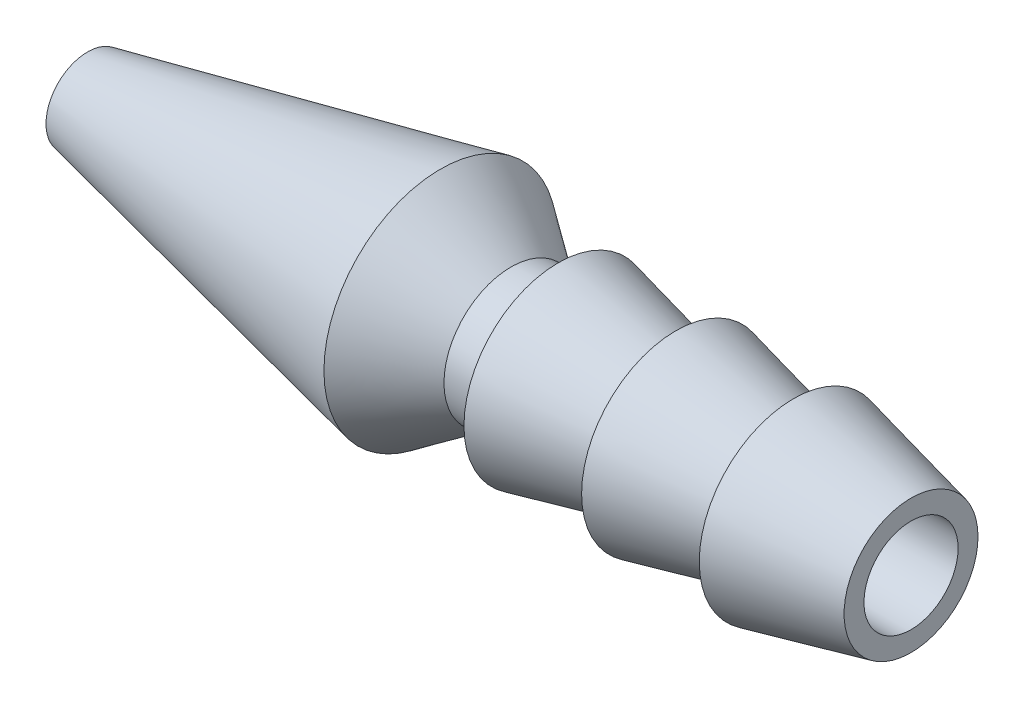
from build123d import *

# Parameters (mm, degrees)
SKETCH1_R           = 4
BOSS_EXTRUDE1_DEPTH = 5
BOSS_EXTRUDE1_TAPER = 13
SKETCH2_R           = 4
BOSS_EXTRUDE2_DEPTH = 5
BOSS_EXTRUDE2_TAPER = 13
SKETCH3_R           = 4
BOSS_EXTRUDE3_DEPTH = 5
BOSS_EXTRUDE3_TAPER = 13
SKETCH4_R           = 2.85
BOSS_EXTRUDE4_DEPTH = 2
SKETCH5_R           = 2.85
BOSS_EXTRUDE5_DEPTH = 3
BOSS_EXTRUDE5_DRAFT = -35
SKETCH6_R           = 4.950622615
BOSS_EXTRUDE6_DEPTH = 15
BOSS_EXTRUDE6_TAPER = 12
SKETCH9_R           = 2
CUT_EXTRUDE1_DEPTH  = 20
SKETCH14_R          = 2
CUT_EXTRUDE11_DEPTH = 10
CUT_EXTRUDE11_TAPER = 11.2
CUT_EXTRUDE13_DEPTH = 10


with BuildPart() as part:
    # Sketch1 → Boss-Extrude1 (new body)
    with BuildSketch(Plane(origin=(0, 0, 0), x_dir=(0, 0, -1), z_dir=(1, 0, 0))):
        Circle(SKETCH1_R)
    extrude(amount=BOSS_EXTRUDE1_DEPTH, taper=BOSS_EXTRUDE1_TAPER)

    # Sketch2 → Boss-Extrude2 (add)
    with BuildSketch(Plane(origin=(5, 0, 0), x_dir=(0, 0, -1), z_dir=(1, 0, 0))):
        Circle(SKETCH2_R)
    extrude(amount=BOSS_EXTRUDE2_DEPTH, taper=BOSS_EXTRUDE2_TAPER)

    # Sketch3 → Boss-Extrude3 (add)
    with BuildSketch(Plane(origin=(10, 0, 0), x_dir=(0, 0, -1), z_dir=(1, 0, 0))):
        Circle(SKETCH3_R)
    extrude(amount=BOSS_EXTRUDE3_DEPTH, taper=BOSS_EXTRUDE3_TAPER)

    # Sketch4 → Boss-Extrude4 (add)
    with BuildSketch(Plane.ZY):
        Circle(SKETCH4_R)
    extrude(amount=BOSS_EXTRUDE4_DEPTH)


with BuildPart() as boss_extrude5_tool:
    # Sketch5 → Boss-Extrude5 (with draft: the straight prism first)
    with BuildSketch(Plane.ZY.offset(2)):
        Circle(SKETCH5_R)
    extrude(amount=BOSS_EXTRUDE5_DEPTH)
    # Boss-Extrude5: the draft: its side faces are tilted about the plane it starts from
    boss_extrude5_sides = [boss_extrude5_tool.faces().sort_by_distance(p)[0] for p in [
        (-3.5, 0, -2.85),
    ]]
    draft(boss_extrude5_sides, Plane.ZY.offset(2), BOSS_EXTRUDE5_DRAFT)


with BuildPart() as part_1:
    add(part.part)

    # Boss-Extrude5: add boss_extrude5_tool
    add(boss_extrude5_tool.part)

    # Sketch6 → Boss-Extrude6 (add)
    with BuildSketch(Plane.ZY.offset(5)):
        Circle(SKETCH6_R)
    extrude(amount=BOSS_EXTRUDE6_DEPTH, taper=BOSS_EXTRUDE6_TAPER)

    # Sketch9 → Cut-Extrude1 (cut)
    with BuildSketch(Plane(origin=(15, 0, 0), x_dir=(0, 0, -1), z_dir=(1, 0, 0))):
        Circle(SKETCH9_R)
    extrude(amount=-CUT_EXTRUDE1_DEPTH, mode=Mode.SUBTRACT)

    # Sketch14 → Cut-Extrude11 (cut)
    with BuildSketch(Plane(origin=(-5, 0, 0), x_dir=(0, 0, -1), z_dir=(1, 0, 0))):
        Circle(SKETCH14_R)
    extrude(amount=-CUT_EXTRUDE11_DEPTH, taper=CUT_EXTRUDE11_TAPER, mode=Mode.SUBTRACT)

    # Sketch15 → Cut-Extrude13 (cut)
    with BuildSketch(Plane.ZY.offset(20)):
        with BuildLine():
            Line((-0.105022345, 0.89385139), (-0.105022345, 1.304678892))
            ThreePointArc((-0.105022345, 1.304678892), (-0.930174079, 0.920865292), (-1.305669179, 0.091895032))
            Line((-1.305669179, 0.091895032), (-0.89529621, 0.091895032))
            ThreePointArc((-0.89529621, 0.091895032), (-0.641048206, 0.631709741), (-0.105022345, 0.89385139))
        make_face()
        with BuildLine():
            ThreePointArc((1.305669179, 0.091895032), (0.932933814, 0.91806928), (0.112852256, 1.30402495))
            Line((0.112852256, 1.30402495), (0.112852256, 0.892896617))
            ThreePointArc((0.112852256, 0.892896617), (0.643810311, 0.628894493), (0.89529621, 0.091895032))
            Line((0.89529621, 0.091895032), (1.305669179, 0.091895032))
        make_face()
        with BuildLine():
            Line((-0.89529621, -0.091895032), (-1.305669179, -0.091895032))
            ThreePointArc((-1.305669179, -0.091895032), (-0.930174079, -0.920865292), (-0.105022345, -1.304678892))
            Line((-0.105022345, -1.304678892), (-0.105022345, -0.89385139))
            ThreePointArc((-0.105022345, -0.89385139), (-0.641048206, -0.631709741), (-0.89529621, -0.091895032))
        make_face()
        with BuildLine():
            ThreePointArc((0, -1.308899042), (0.892450386, -0.95747011), (1.305669179, -0.091895032))
            Line((1.305669179, -0.091895032), (0.89529621, -0.091895032))
            ThreePointArc((0.89529621, -0.091895032), (0.643810311, -0.628894493), (0.112852256, -0.892896617))
            ThreePointArc((0.112852256, -0.892896617), (0.056537797, -0.898222399), (0, -0.9))
            Line((0, -0.9), (0, -1.308899042))
        make_face()
    extrude(amount=-CUT_EXTRUDE13_DEPTH, mode=Mode.SUBTRACT)


solid = part_1.part
